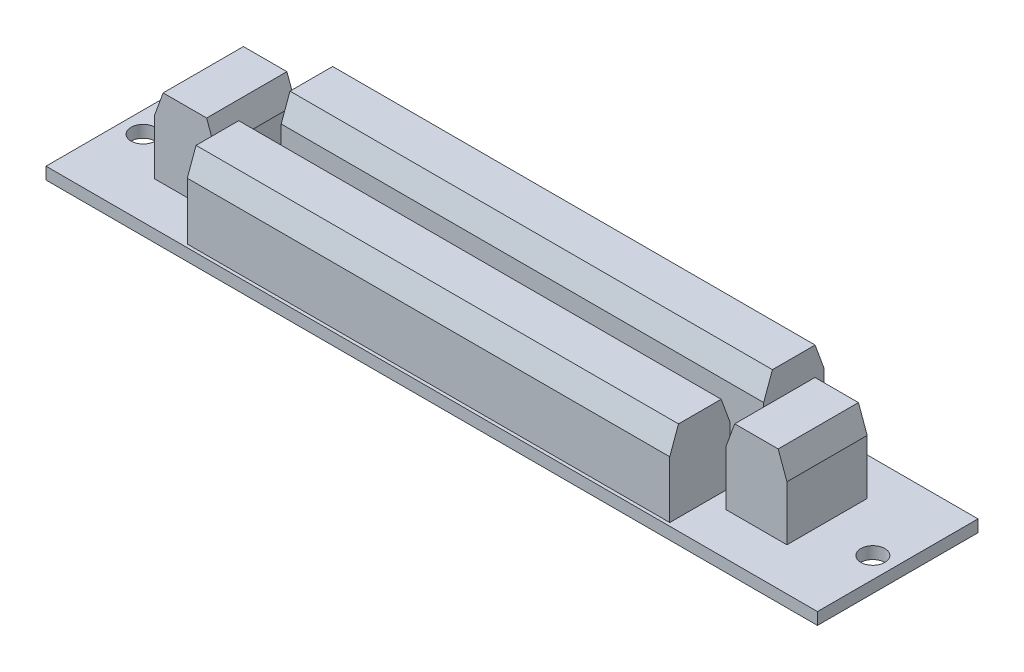
from build123d import *
from OCP.BRepFilletAPI import BRepFilletAPI_MakeChamfer

# Parameters (mm, degrees)
SKETCH1_W                 = 96.1
SKETCH1_H                 = 20
SKETCH1_R                 = 1.5
BOSS_EXTRUDE1_DEPTH       = 1.5
SKETCH2_W                 = 60.1
SKETCH2_H                 = 7.5
BOSS_EXTRUDE2_DEPTH       = 10.1
CHAMFER1_SIZE             = 3
CHAMFER1_SIZE2            = 1.091910703
CHAMFER1_OF_MIRROR1_SIZE  = 3
CHAMFER1_OF_MIRROR1_SIZE2 = 1.091910703
SKETCH3_W                 = 7.6
SKETCH3_H                 = 10
BOSS_EXTRUDE3_DEPTH       = 9.8
CHAMFER2_SIZE             = 3
CHAMFER2_SIZE2            = 1.091910703


with BuildPart() as part:
    # Sketch1 → Boss-Extrude1 (new body)
    with BuildSketch(Plane(origin=(0, 0, 0), x_dir=(1, 0, 0), z_dir=(0, 1, 0))):
        with Locations((48.05, 10)):
            Rectangle(SKETCH1_W, SKETCH1_H)
        with Locations(Location((2.6, 9.5, 0), (0, 0, 270))):
            Circle(SKETCH1_R, mode=Mode.SUBTRACT)
        with Locations(Location((93.5, 9.5, 0), (0, 0, 270))):
            Circle(SKETCH1_R, mode=Mode.SUBTRACT)
    extrude(amount=BOSS_EXTRUDE1_DEPTH)

    # Sketch2 → Boss-Extrude2 (add)
    with BuildSketch(Plane(origin=(0, 1.5, 0), x_dir=(1, 0, 0), z_dir=(0, 1, 0))):
        with Locations((47.25, 4.15)):
            Rectangle(SKETCH2_W, SKETCH2_H)
    boss_extrude2 = extrude(amount=BOSS_EXTRUDE2_DEPTH)

    # Chamfer1: one chamfer whose edges measure the first distance from different faces: ONE call of the kernel's chamfer builder (chamfer() names one face for all edges)
    chamfer1_edges_1 = [part.edges().sort_by_distance(p)[0] for p in [
        (47.25, 11.6, -0.4),
    ]]
    chamfer1_side_1 = [part.faces().sort_by_distance(p)[0] for p in [
        (47.25, 6.55, -0.4),
    ]]
    chamfer1_edges_2 = [part.edges().sort_by_distance(p)[0] for p in [
        (47.25, 11.6, -7.9),
    ]]
    chamfer1_side_2 = [part.faces().sort_by_distance(p)[0] for p in [
        (47.25, 6.55, -7.9),
    ]]
    chamfer1 = BRepFilletAPI_MakeChamfer(part.part.solid().wrapped)
    for e in chamfer1_edges_1:
        chamfer1.Add(CHAMFER1_SIZE, CHAMFER1_SIZE2, e.wrapped, chamfer1_side_1[0].wrapped)  # the first distance lies on this face
    for e in chamfer1_edges_2:
        chamfer1.Add(CHAMFER1_SIZE, CHAMFER1_SIZE2, e.wrapped, chamfer1_side_2[0].wrapped)  # the first distance lies on this face
    add(Compound.cast(chamfer1.Shape()), mode=Mode.REPLACE)

    # Mirror1: Boss-Extrude2 across plane
    add(boss_extrude2.mirror(Plane.XY.offset(-10)))

    # Chamfer1 of Mirror1: one chamfer whose edges measure the first distance from different faces: ONE call of the kernel's chamfer builder (chamfer() names one face for all edges)
    chamfer1_of_mirror1_edges_1 = [part.edges().sort_by_distance(p)[0] for p in [
        (47.25, 11.6, -19.6),
    ]]
    chamfer1_of_mirror1_side_1 = [part.faces().sort_by_distance(p)[0] for p in [
        (47.25, 6.55, -19.6),
    ]]
    chamfer1_of_mirror1_edges_2 = [part.edges().sort_by_distance(p)[0] for p in [
        (47.25, 11.6, -12.1),
    ]]
    chamfer1_of_mirror1_side_2 = [part.faces().sort_by_distance(p)[0] for p in [
        (47.25, 6.55, -12.1),
    ]]
    chamfer1_of_mirror1 = BRepFilletAPI_MakeChamfer(part.part.solid().wrapped)
    for e in chamfer1_of_mirror1_edges_1:
        chamfer1_of_mirror1.Add(CHAMFER1_OF_MIRROR1_SIZE, CHAMFER1_OF_MIRROR1_SIZE2, e.wrapped, chamfer1_of_mirror1_side_1[0].wrapped)  # the first distance lies on this face
    for e in chamfer1_of_mirror1_edges_2:
        chamfer1_of_mirror1.Add(CHAMFER1_OF_MIRROR1_SIZE, CHAMFER1_OF_MIRROR1_SIZE2, e.wrapped, chamfer1_of_mirror1_side_2[0].wrapped)  # the first distance lies on this face
    add(Compound.cast(chamfer1_of_mirror1.Shape()), mode=Mode.REPLACE)

    # Sketch3 → Boss-Extrude3 (add)
    with BuildSketch(Plane(origin=(0, 1.5, 0), x_dir=(1, 0, 0), z_dir=(0, 1, 0))):
        with Locations((11.9, 10.4)):
            Rectangle(SKETCH3_W, SKETCH3_H)
        with Locations((83.2, 10.3)):
            Rectangle(SKETCH3_W, SKETCH3_H)
    extrude(amount=BOSS_EXTRUDE3_DEPTH)

    # Chamfer2: one chamfer whose edges measure the first distance from different faces: ONE call of the kernel's chamfer builder (chamfer() names one face for all edges)
    chamfer2_edges_1 = [part.edges().sort_by_distance(p)[0] for p in [
        (8.1, 11.3, -10.4),
    ]]
    chamfer2_side_1 = [part.faces().sort_by_distance(p)[0] for p in [
        (8.1, 6.4, -10.4),
    ]]
    chamfer2_edges_2 = [part.edges().sort_by_distance(p)[0] for p in [
        (15.7, 11.3, -10.4),
    ]]
    chamfer2_side_2 = [part.faces().sort_by_distance(p)[0] for p in [
        (15.7, 6.4, -10.4),
    ]]
    chamfer2_edges_3 = [part.edges().sort_by_distance(p)[0] for p in [
        (79.4, 11.3, -10.3),
    ]]
    chamfer2_side_3 = [part.faces().sort_by_distance(p)[0] for p in [
        (79.4, 6.4, -10.3),
    ]]
    chamfer2_edges_4 = [part.edges().sort_by_distance(p)[0] for p in [
        (87, 11.3, -10.3),
    ]]
    chamfer2_side_4 = [part.faces().sort_by_distance(p)[0] for p in [
        (87, 6.4, -10.3),
    ]]
    chamfer2 = BRepFilletAPI_MakeChamfer(part.part.solid().wrapped)
    for e in chamfer2_edges_1:
        chamfer2.Add(CHAMFER2_SIZE, CHAMFER2_SIZE2, e.wrapped, chamfer2_side_1[0].wrapped)  # the first distance lies on this face
    for e in chamfer2_edges_2:
        chamfer2.Add(CHAMFER2_SIZE, CHAMFER2_SIZE2, e.wrapped, chamfer2_side_2[0].wrapped)  # the first distance lies on this face
    for e in chamfer2_edges_3:
        chamfer2.Add(CHAMFER2_SIZE, CHAMFER2_SIZE2, e.wrapped, chamfer2_side_3[0].wrapped)  # the first distance lies on this face
    for e in chamfer2_edges_4:
        chamfer2.Add(CHAMFER2_SIZE, CHAMFER2_SIZE2, e.wrapped, chamfer2_side_4[0].wrapped)  # the first distance lies on this face
    add(Compound.cast(chamfer2.Shape()), mode=Mode.REPLACE)


solid = part.part
